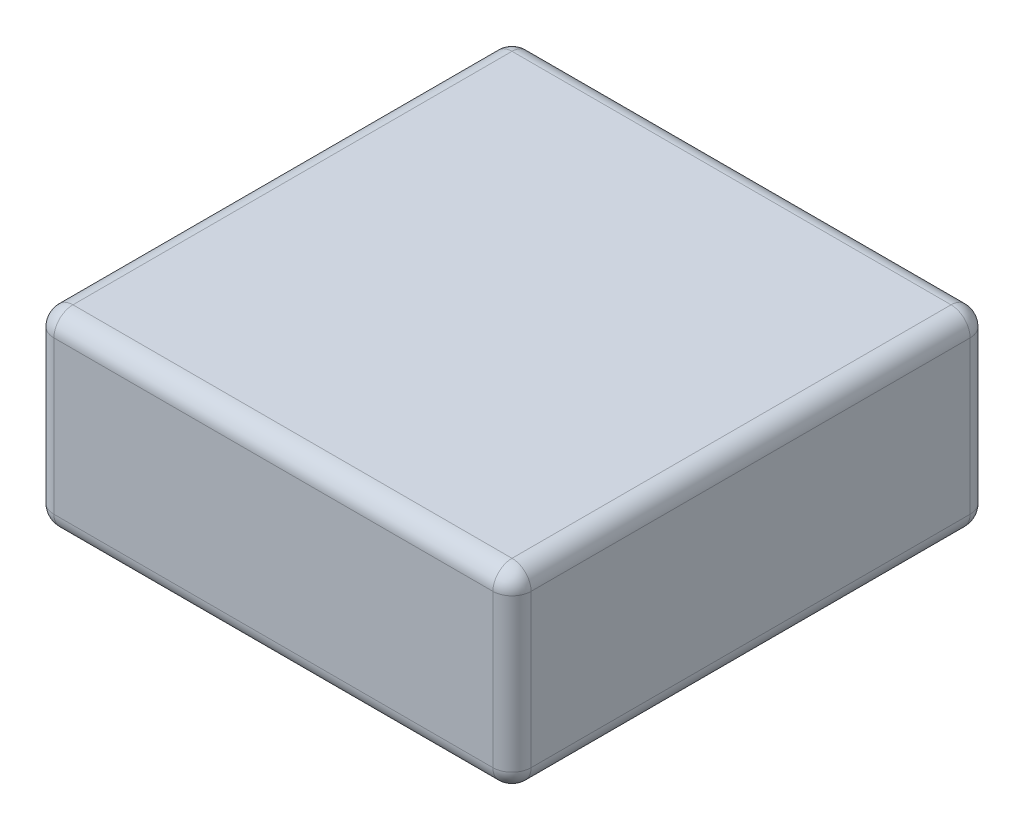
from build123d import *

# Parameters (mm, degrees)
SKETCH_1_W      = 50
SKETCH_1_H      = 50
EXTRUDE_1_DEPTH = 10
FILLET_1_R      = 2


with BuildPart() as part:
    # 草图1 → 凸台-拉伸1 (new, symmetric)
    with BuildSketch(Plane(origin=(0, 0, 0), x_dir=(1, 0, 0), z_dir=(0, 1, 0))):
        Rectangle(SKETCH_1_W, SKETCH_1_H)
    extrude(amount=EXTRUDE_1_DEPTH, both=True)

    # 圆角1
    fillet_1_edges = [part.edges().sort_by_distance(p)[0] for p in [
        (-25, 10, 0),
        (0, 10, 25),
        (25, 10, 0),
        (0, -10, 25),
        (-25, -10, 0),
        (0, -10, -25),
        (25, -10, 0),
        (25, 0, 25),
        (-25, 0, 25),
        (-25, 0, -25),
        (25, 0, -25),
        (0, 10, -25),
    ]]
    fillet(fillet_1_edges, radius=FILLET_1_R)


solid = part.part
